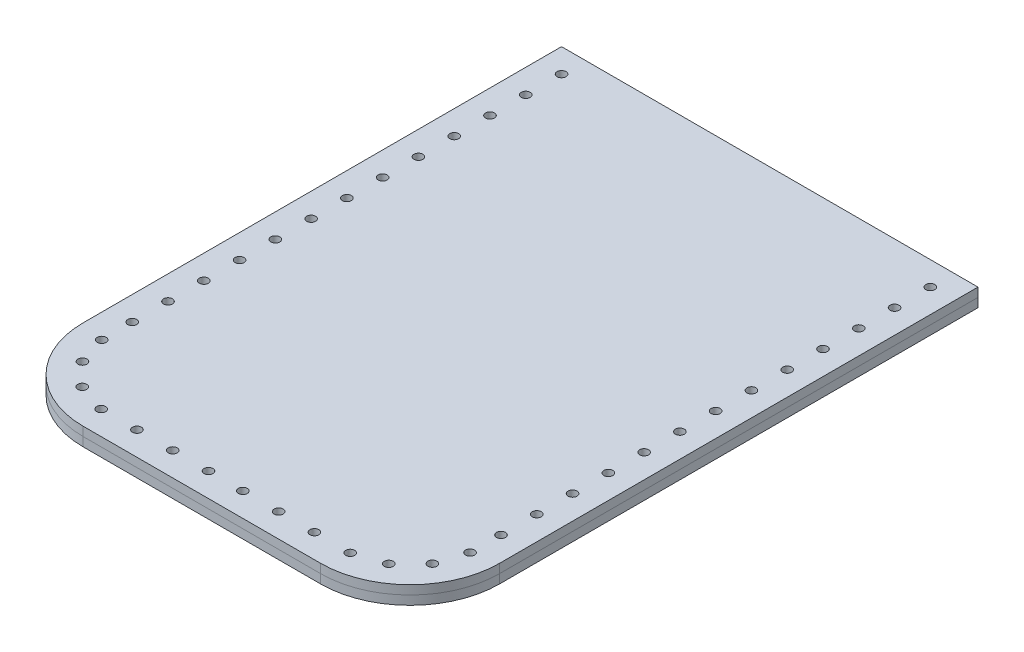
from build123d import *

# Parameters (mm, degrees)
FRONT_PANEL_DEPTH       = 1.5
BACK_PANEL_DEPTH        = 1.5
CUT_EXTRUDE1_DEPTH      = 60.134560538
CUT_EXTRUDE1_DEPTH_BACK = 60.134560538
SKETCH5_R               = 0.75


with BuildPart() as part:
    # Sketch1 → front panel (new body)
    with BuildSketch(Plane(origin=(0, 0, 0), x_dir=(1, 0, 0), z_dir=(0, 1, 0))):
        with BuildLine():
            Line((-19.925, -47.625), (19.925, -47.625))
            ThreePointArc((19.925, -47.625), (30.531601718, -43.231601718), (34.925, -32.625))
            Line((34.925, -32.625), (34.925, 47.625))
            Line((34.925, 47.625), (-34.925, 47.625))
            Line((-34.925, 47.625), (-34.925, -32.625))
            ThreePointArc((-34.925, -32.625), (-30.531601718, -43.231601718), (-19.925, -47.625))
        make_face()
    extrude(amount=FRONT_PANEL_DEPTH)


with BuildPart() as body_2:
    # Sketch3 → back panel (new body)
    with BuildSketch(Plane.XZ):
        with BuildLine():
            Line((34.925, -47.625), (28.575, -47.625))
            Line((28.575, -47.625), (0, -19.05))
            Line((0, -19.05), (-28.575, -47.625))
            Line((-28.575, -47.625), (-34.925, -47.625))
            Line((-34.925, -47.625), (-34.925, 32.625))
            ThreePointArc((-34.925, 32.625), (-30.531601718, 43.231601718), (-19.925, 47.625))
            Line((-19.925, 47.625), (19.925, 47.625))
            ThreePointArc((19.925, 47.625), (30.531601718, 43.231601718), (34.925, 32.625))
            Line((34.925, 32.625), (34.925, -47.625))
        make_face()
    extrude(amount=BACK_PANEL_DEPTH)


with BuildPart() as cut_extrude1_tool:
    # Sketch5 → Cut-Extrude1 (new, two sides: drawn at the far end of the back side and taken through both)
    with BuildSketch(Plane(origin=(0, 1.5, 0), x_dir=(1, 0, 0), z_dir=(0, 1, 0)).offset(-CUT_EXTRUDE1_DEPTH_BACK)):
        with Locations(Location((-30.925, 43.625, 0), (0, 0, 270))):
            Circle(SKETCH5_R)
        with Locations(Location((-30.925, 37.625, 0), (0, 0, 270))):
            Circle(SKETCH5_R)
        with Locations(Location((-30.925, 31.625, 0), (0, 0, 270))):
            Circle(SKETCH5_R)
        with Locations(Location((-30.925, 25.625, 0), (0, 0, 270))):
            Circle(SKETCH5_R)
        with Locations(Location((-30.925, 19.625, 0), (0, 0, 270))):
            Circle(SKETCH5_R)
        with Locations(Location((-30.925, 13.625, 0), (0, 0, 270))):
            Circle(SKETCH5_R)
        with Locations(Location((-30.925, 7.625, 0), (0, 0, 270))):
            Circle(SKETCH5_R)
        with Locations(Location((-30.925, 1.625, 0), (0, 0, 270))):
            Circle(SKETCH5_R)
        with Locations(Location((-30.925, -4.375, 0), (0, 0, 270))):
            Circle(SKETCH5_R)
        with Locations(Location((-30.925, -10.375, 0), (0, 0, 270))):
            Circle(SKETCH5_R)
        with Locations(Location((-30.925, -16.375, 0), (0, 0, 270))):
            Circle(SKETCH5_R)
        with Locations(Location((-30.925, -22.375, 0), (0, 0, 270))):
            Circle(SKETCH5_R)
        with Locations(Location((-30.925, -28.375, 0), (0, 0, 270))):
            Circle(SKETCH5_R)
        with Locations(Location((-30.887706281, -33.530025412, 0), (0, 0, 270))):
            Circle(SKETCH5_R)
        with Locations(Location((-29.347254895, -38.30136439, 0), (0, 0, 270))):
            Circle(SKETCH5_R)
        with Locations(Location((-25.705841038, -41.983518948, 0), (0, 0, 270))):
            Circle(SKETCH5_R)
        with Locations(Location((-2.882796486, -43.625, 0), (0, 0, 270))):
            Circle(SKETCH5_R)
        with Locations(Location((-8.882796486, -43.625, 0), (0, 0, 270))):
            Circle(SKETCH5_R)
        with Locations(Location((-14.882796486, -43.625, 0), (0, 0, 270))):
            Circle(SKETCH5_R)
        with Locations(Location((-20.882796486, -43.625, 0), (0, 0, 270))):
            Circle(SKETCH5_R)
        with Locations(Location((20.882796486, -43.625, 0), (0, 0, 90))):
            Circle(SKETCH5_R)
        with Locations(Location((14.882796486, -43.625, 0), (0, 0, 90))):
            Circle(SKETCH5_R)
        with Locations(Location((8.882796486, -43.625, 0), (0, 0, 90))):
            Circle(SKETCH5_R)
        with Locations(Location((2.882796486, -43.625, 0), (0, 0, 90))):
            Circle(SKETCH5_R)
        with Locations(Location((25.705841038, -41.983518948, 0), (0, 0, 90))):
            Circle(SKETCH5_R)
        with Locations(Location((29.347254895, -38.30136439, 0), (0, 0, 90))):
            Circle(SKETCH5_R)
        with Locations(Location((30.887706281, -33.530025412, 0), (0, 0, 90))):
            Circle(SKETCH5_R)
        with Locations(Location((30.925, -28.375, 0), (0, 0, 90))):
            Circle(SKETCH5_R)
        with Locations(Location((30.925, -22.375, 0), (0, 0, 90))):
            Circle(SKETCH5_R)
        with Locations(Location((30.925, -16.375, 0), (0, 0, 90))):
            Circle(SKETCH5_R)
        with Locations(Location((30.925, -10.375, 0), (0, 0, 90))):
            Circle(SKETCH5_R)
        with Locations(Location((30.925, -4.375, 0), (0, 0, 90))):
            Circle(SKETCH5_R)
        with Locations(Location((30.925, 1.625, 0), (0, 0, 90))):
            Circle(SKETCH5_R)
        with Locations(Location((30.925, 7.625, 0), (0, 0, 90))):
            Circle(SKETCH5_R)
        with Locations(Location((30.925, 13.625, 0), (0, 0, 90))):
            Circle(SKETCH5_R)
        with Locations(Location((30.925, 19.625, 0), (0, 0, 90))):
            Circle(SKETCH5_R)
        with Locations(Location((30.925, 25.625, 0), (0, 0, 90))):
            Circle(SKETCH5_R)
        with Locations(Location((30.925, 31.625, 0), (0, 0, 90))):
            Circle(SKETCH5_R)
        with Locations(Location((30.925, 37.625, 0), (0, 0, 90))):
            Circle(SKETCH5_R)
        with Locations(Location((30.925, 43.625, 0), (0, 0, 90))):
            Circle(SKETCH5_R)
    extrude(amount=CUT_EXTRUDE1_DEPTH + CUT_EXTRUDE1_DEPTH_BACK)


with BuildPart() as part_1:
    add(part.part)

    # Cut-Extrude1: cut by cut_extrude1_tool
    add(cut_extrude1_tool.part, mode=Mode.SUBTRACT)


with BuildPart() as body_2_1:
    add(body_2.part)

    # Cut-Extrude1: cut by cut_extrude1_tool
    add(cut_extrude1_tool.part, mode=Mode.SUBTRACT)


solid = Compound([part_1.part, body_2_1.part])
